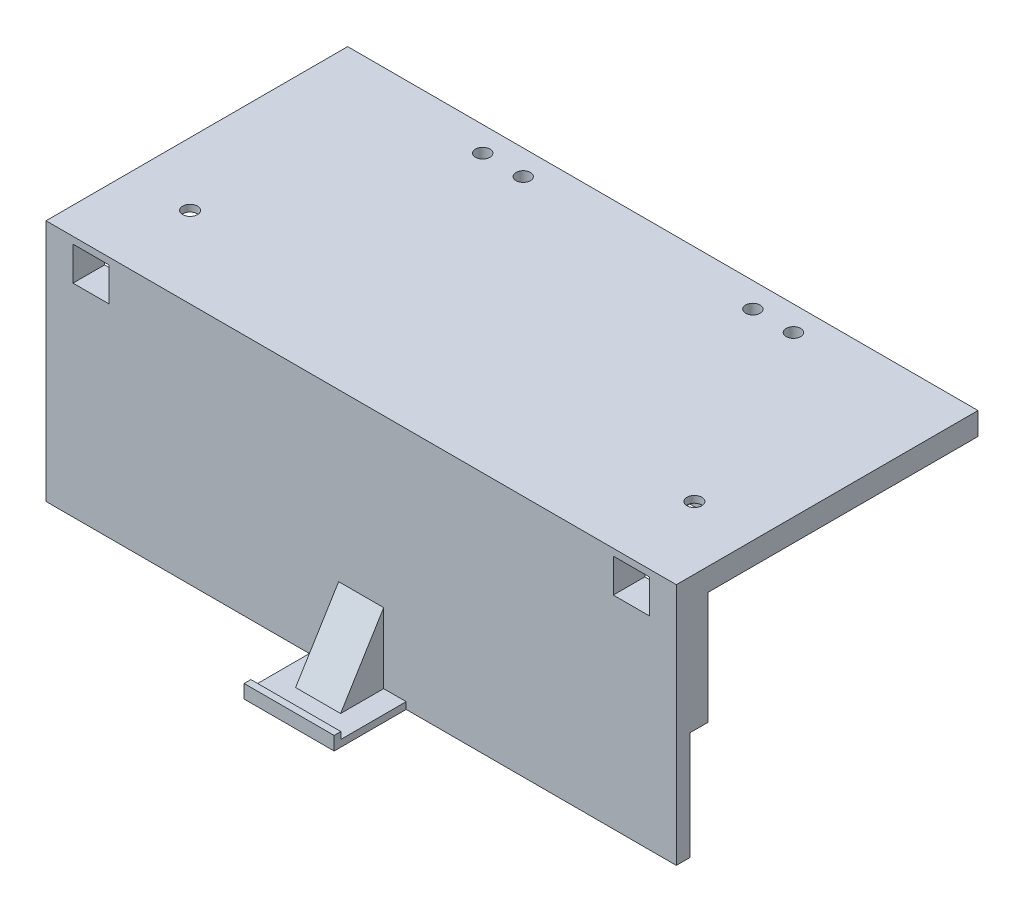
from build123d import *

# Parameters (mm, degrees)
EXTRUDE_1_DEPTH     = 140
SKETCH_2_R          = 1.65
CUT_EXTRUDE_1_DEPTH = 5
SKETCH_3_W          = 8
SKETCH_3_H          = 7.5
CUT_EXTRUDE_2_DEPTH = 146.701750161
SKETCH_4_W          = 10
SKETCH_4_H          = 8
CUT_EXTRUDE_3_DEPTH = 3.5
SKETCH_5_W          = 20
SKETCH_5_H          = 1.5
EXTRUDE_2_DEPTH     = 16
SKETCH_6_W          = 1.5
SKETCH_6_H          = 1.5
EXTRUDE_3_DEPTH     = 20
RIB_1_REACH         = 83.179
SKETCH_8_WALL_W     = 182.645829166
SKETCH_8_WALL_H     = 10
SKETCH_9_W          = 140
SKETCH_9_H          = 5
EXTRUDE_4_DEPTH     = 37
SKETCH_10_R         = 1.6
CUT_EXTRUDE_4_DEPTH = 5


with BuildPart() as part:
    # 草图1 → 凸台-拉伸1 (new body)
    with BuildSketch(Plane(origin=(0, 0, 0), x_dir=(0, 0, -1), z_dir=(1, 0, 0))):
        Polygon((-15, 27), (15, 27), (15, 22), (-8, 22), (-8, 17), (-8, -3), (-12, -3), (-12, -27), (-15, -27), align=None)
    extrude(amount=EXTRUDE_1_DEPTH)

    # 草图2 → 切除-拉伸1 (cut)
    with BuildSketch(Plane(origin=(0, 27, 0), x_dir=(1, 0, 0), z_dir=(0, 1, 0))):
        with Locations(Location((14, 3, 0), (0, 0, 270))):
            Circle(SKETCH_2_R)
        with Locations(Location((126, 3, 0), (0, 0, 270))):
            Circle(SKETCH_2_R)
    extrude(amount=-CUT_EXTRUDE_1_DEPTH, mode=Mode.SUBTRACT)

    # 草图3 → 切除-拉伸2 (cut, through all)
    with BuildSketch(Plane.XY.offset(15)):
        with Locations((10, 21.75)):
            Rectangle(SKETCH_3_W, SKETCH_3_H)
        with Locations((130, 21.75)):
            Rectangle(SKETCH_3_W, SKETCH_3_H)
    extrude(amount=-CUT_EXTRUDE_2_DEPTH, mode=Mode.SUBTRACT)

    # 草图4 → 切除-拉伸3 (cut)
    with BuildSketch(Plane.XZ.offset(-22)):
        with Locations((14, -3)):
            Rectangle(SKETCH_4_W, SKETCH_4_H)
        with Locations((126, -3)):
            Rectangle(SKETCH_4_W, SKETCH_4_H)
    extrude(amount=-CUT_EXTRUDE_3_DEPTH, mode=Mode.SUBTRACT)

    # 草图5 → 凸台-拉伸2 (add)
    with BuildSketch(Plane.XY.offset(15)):
        with Locations((70, -26.25)):
            Rectangle(SKETCH_5_W, SKETCH_5_H)
    extrude(amount=EXTRUDE_2_DEPTH)

    # 草图6 → 凸台-拉伸3 (add)
    with BuildSketch(Plane(origin=(80, 0, 0), x_dir=(0, 0, -1), z_dir=(1, 0, 0))):
        with Locations((-30.25, -24.75)):
            Rectangle(SKETCH_6_W, SKETCH_6_H)
    extrude(amount=-EXTRUDE_3_DEPTH)

    # 草图8 wall → 筋1 (add, up to next)
    with BuildSketch(Plane(origin=(70, -17.707455467, 19.784433865), x_dir=(0, -0.852193749384, 0.523226350168), z_dir=(0, 0.523226350168, 0.852193749384)), mode=Mode.PRIVATE) as rib_1_sk1:
        Rectangle(SKETCH_8_WALL_W, SKETCH_8_WALL_H)
    rib_1_tool1 = extrude(rib_1_sk1.sketch, amount=-RIB_1_REACH, mode=Mode.PRIVATE) - part.part
    add(rib_1_tool1.solids().sort_by_distance((70, -17.707455467, 19.784433865))[0])

    # 草图9 → 凸台-拉伸4 (add)
    with BuildSketch(Plane(origin=(0, 0, -15), x_dir=(-1, 0, 0), z_dir=(0, 0, -1))):
        with Locations((-70, 24.5)):
            Rectangle(SKETCH_9_W, SKETCH_9_H)
    extrude(amount=EXTRUDE_4_DEPTH)

    # 草图10 → 切除-拉伸4 (cut)
    with BuildSketch(Plane(origin=(0, 27, 0), x_dir=(1, 0, 0), z_dir=(0, 1, 0))):
        with Locations(Location((35.5, 46.5, 0), (0, 0, 270))):
            Circle(SKETCH_10_R)
        with Locations(Location((44.5, 46.5, 0), (0, 0, 270))):
            Circle(SKETCH_10_R)
        with Locations(Location((95.5, 46.5, 0), (0, 0, 270))):
            Circle(SKETCH_10_R)
        with Locations(Location((104.5, 46.5, 0), (0, 0, 270))):
            Circle(SKETCH_10_R)
    extrude(amount=-CUT_EXTRUDE_4_DEPTH, mode=Mode.SUBTRACT)


solid = part.part
